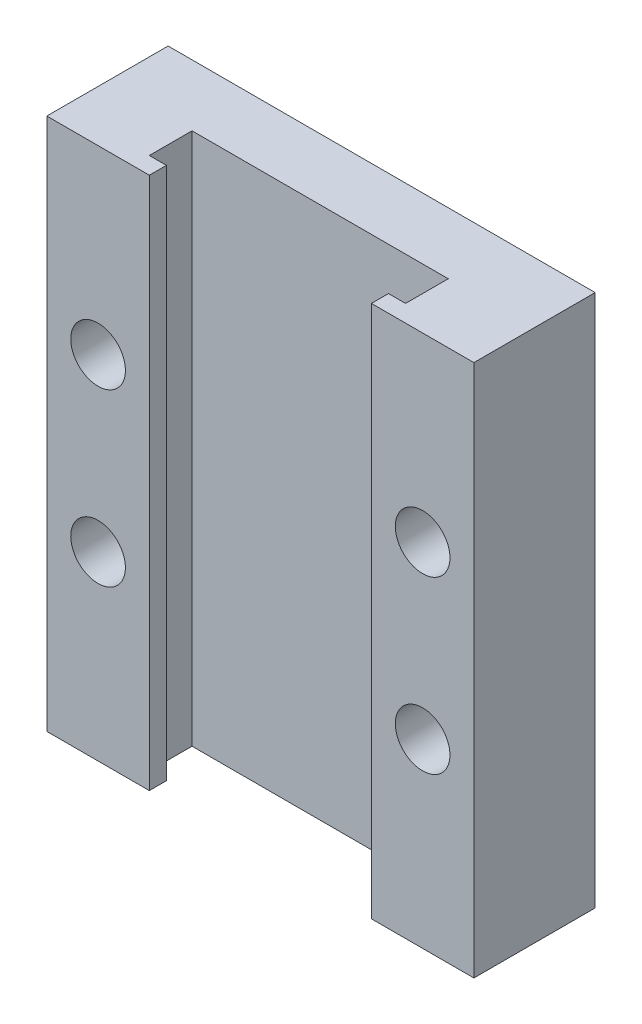
from build123d import *

# Parameters (mm, degrees)
EXTRUDE_1_DEPTH     = 31.2
SKETCH_2_R          = 1.6
CUT_EXTRUDE_1_DEPTH = 10


with BuildPart() as part:
    # 草图1 → 凸台-拉伸1 (new body)
    with BuildSketch(Plane(origin=(0, 0, 0), x_dir=(1, 0, 0), z_dir=(0, 1, 0))):
        Polygon((-7.5, -0.275116875), (-6.5, -0.275116875), (-6.5, -1.275116875), (-12.5, -1.275116875), (-12.5, 5.824883125), (12.5, 5.824883125), (12.5, -1.275116875), (6.5, -1.275116875), (6.5, -0.275116875), (7.5, -0.275116875), (7.5, 2.224883125), (-7.5, 2.224883125), align=None)
    extrude(amount=EXTRUDE_1_DEPTH)

    # 草图2 → 切除-拉伸1 (cut)
    with BuildSketch(Plane(origin=(0, 0, -5.824883125), x_dir=(-1, 0, 0), z_dir=(0, 0, -1))):
        with Locations((-9.5, 20.6)):
            Circle(SKETCH_2_R)
        with Locations((9.5, 20.6)):
            Circle(SKETCH_2_R)
        with Locations((9.5, 10.6)):
            Circle(SKETCH_2_R)
        with Locations((-9.5, 10.6)):
            Circle(SKETCH_2_R)
    extrude(amount=-CUT_EXTRUDE_1_DEPTH, mode=Mode.SUBTRACT)


solid = part.part
